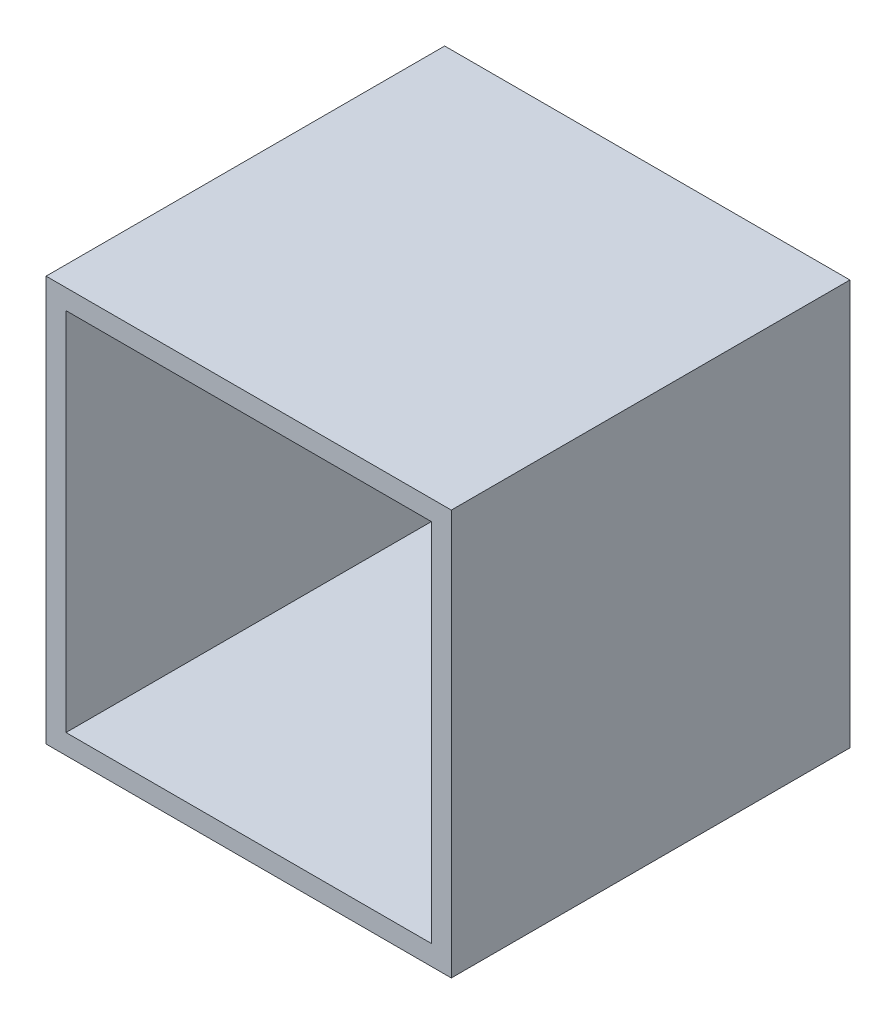
from build123d import *

# Parameters (mm, degrees)
SKETCH1_W           = 61
SKETCH1_H           = 61
SKETCH1_W_2         = 55
SKETCH1_H_2         = 55
BOSS_EXTRUDE1_DEPTH = 60
SKETCH2_W           = 61
SKETCH2_H           = 61
BOSS_EXTRUDE2_DEPTH = 3
CUT_EXTRUDE1_DEPTH  = 3


with BuildPart() as part:
    # Sketch1 → Boss-Extrude1 (new body)
    with BuildSketch(Plane.XY):
        Rectangle(SKETCH1_W, SKETCH1_H)
        Rectangle(SKETCH1_W_2, SKETCH1_H_2, mode=Mode.SUBTRACT)
    extrude(amount=BOSS_EXTRUDE1_DEPTH)

    # Sketch2 → Boss-Extrude2 (add)
    with BuildSketch(Plane(origin=(0, 0, 0), x_dir=(-1, 0, 0), z_dir=(0, 0, -1))):
        Rectangle(SKETCH2_W, SKETCH2_H)
    extrude(amount=-BOSS_EXTRUDE2_DEPTH)

    # Sketch3 → Cut-Extrude1 (cut)
    with BuildSketch(Plane(origin=(0, 0, 0), x_dir=(-1, 0, 0), z_dir=(0, 0, -1))):
        with BuildLine():
            ThreePointArc((14, -9.5), (12.939339828, -9.939339828), (12.5, -11))
            Line((12.5, -11), (14, -11))
            Line((14, -11), (14, -9.5))
        make_face()
        with BuildLine():
            Line((14, -11), (12.5, -11))
            ThreePointArc((12.5, -11), (14, -12.5), (15.5, -11))
            ThreePointArc((15.5, -11), (15.060660172, -9.939339828), (14, -9.5))
            Line((14, -9.5), (14, -11))
        make_face()
        with BuildLine():
            Line((-14, -9.5), (-14, -11))
            Line((-14, -11), (-12.5, -11))
            ThreePointArc((-12.5, -11), (-12.939339828, -9.939339828), (-14, -9.5))
        make_face()
        with BuildLine():
            Line((-12.5, -11), (-14, -11))
            Line((-14, -11), (-14, -9.5))
            ThreePointArc((-14, -9.5), (-15.060660172, -12.060660172), (-12.5, -11))
        make_face()
        with BuildLine():
            ThreePointArc((12.5, 11), (12.939339828, 9.939339828), (14, 9.5))
            Line((14, 9.5), (14, 11))
            Line((14, 11), (12.5, 11))
        make_face()
        with BuildLine():
            Line((14, 11), (14, 9.5))
            ThreePointArc((14, 9.5), (15.060660172, 9.939339828), (15.5, 11))
            ThreePointArc((15.5, 11), (14, 12.5), (12.5, 11))
            Line((12.5, 11), (14, 11))
        make_face()
        with BuildLine():
            ThreePointArc((-12.5, 11), (-15.060660172, 12.060660172), (-14, 9.5))
            Line((-14, 9.5), (-14, 11))
            Line((-14, 11), (-12.5, 11))
        make_face()
        with BuildLine():
            Line((-14, 11), (-14, 9.5))
            ThreePointArc((-14, 9.5), (-12.939339828, 9.939339828), (-12.5, 11))
            Line((-12.5, 11), (-14, 11))
        make_face()
    extrude(amount=-CUT_EXTRUDE1_DEPTH, mode=Mode.SUBTRACT)


solid = part.part
